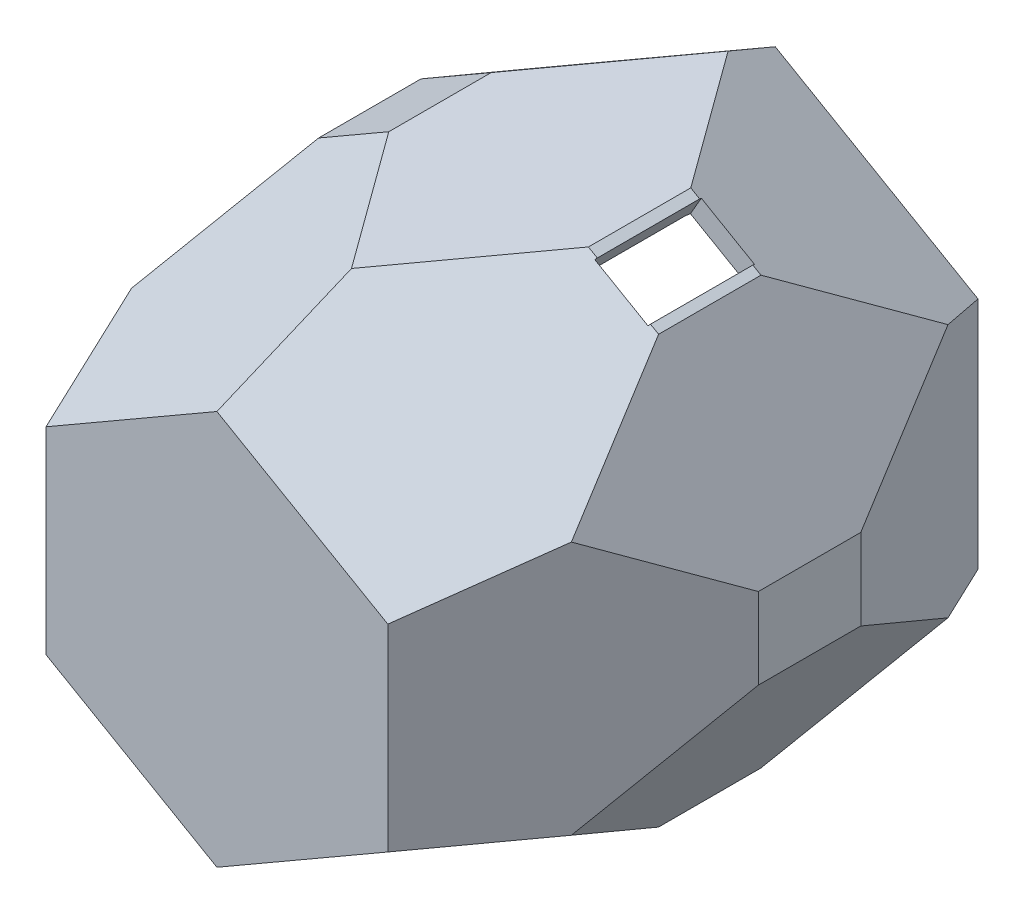
from build123d import *

# Parameters (mm, degrees)
BOSS_EXTRUDE1_DEPTH = 45
BOSS_EXTRUDE1_DRAFT = -20
BOSS_EXTRUDE3_DEPTH = 25
BOSS_EXTRUDE4_DEPTH = 66.34
BOSS_EXTRUDE4_TAPER = 20
SKETCH5_W           = 60
SKETCH5_H           = 136.34
CUT_EXTRUDE4_DEPTH  = 15
CIRPATTERN1_COUNT   = 6
SHELL1_T            = -5
SKETCH6_W           = 15
SKETCH6_H           = 26
CUT_EXTRUDE5_DEPTH  = 10


with BuildPart() as part:
    # Sketch1 → Boss-Extrude1 (with draft: the straight prism first)
    with BuildSketch(Plane.XY):
        Polygon((0, 57.15767665), (-49.5, 28.578838325), (-49.5, -28.578838325), (0, -57.15767665), (49.5, -28.578838325), (49.5, 28.578838325), align=None)
    extrude(amount=BOSS_EXTRUDE1_DEPTH)
    # Boss-Extrude1: the draft: its side faces are tilted about the plane it starts from
    boss_extrude1_sides = [part.faces().sort_by_distance(p)[0] for p in [
        (-24.75, 42.868257487, 22.5),
        (-49.5, 0, 22.5),
        (-24.75, -42.868257487, 22.5),
        (24.75, -42.868257487, 22.5),
        (49.5, 0, 22.5),
        (24.75, 42.868257487, 22.5),
    ]]
    draft(boss_extrude1_sides, Plane.XY, BOSS_EXTRUDE1_DRAFT)

    # Sketch3 → Boss-Extrude3 (add)
    with BuildSketch(Plane.XY.offset(45)):
        Polygon((0, -76.070124796), (65.878660542, -38.035062398), (65.878660542, 38.035062398), (0, 76.070124796), (-65.878660542, 38.035062398), (-65.878660542, -38.035062398), align=None)
    extrude(amount=BOSS_EXTRUDE3_DEPTH)

    # Sketch4 → Boss-Extrude4 (add)
    with BuildSketch(Plane.XY.offset(70)):
        Polygon((65.878660542, -38.035062398), (65.878660542, 38.035062398), (0, 76.070124796), (-65.878660542, 38.035062398), (-65.878660542, -38.035062398), (0, -76.070124796), align=None)
    extrude(amount=BOSS_EXTRUDE4_DEPTH, taper=BOSS_EXTRUDE4_TAPER)

    # Sketch5 → Cut-Extrude4 (cut)
    with BuildSketch(Plane(origin=(0, 77, 0), x_dir=(1, 0, 0), z_dir=(0, 1, 0))):
        with Locations((0, -68.17)):
            Rectangle(SKETCH5_W, SKETCH5_H)
    cut_extrude4 = extrude(amount=-CUT_EXTRUDE4_DEPTH, mode=Mode.SUBTRACT)

    # CirPattern1: Cut-Extrude4 ×6 about axis
    cirpattern1_axis = Axis((0, 0, 0), (0, 0, 1))
    for i in range(1, CIRPATTERN1_COUNT):
        add(cut_extrude4.rotate(cirpattern1_axis, i * 360 / CIRPATTERN1_COUNT), mode=Mode.SUBTRACT)

    # Shell1
    shell1_openings = [part.faces().sort_by_distance(p)[0] for p in [
        (0, 0, 0),
    ]]
    offset(amount=SHELL1_T, openings=shell1_openings, kind=Kind.INTERSECTION)

    # Sketch6 → Cut-Extrude5 (cut)
    with BuildSketch(Plane(origin=(32.939330271, 57.052593597, 0), x_dir=(0.8660254037844417, -0.49999999999999467, 0), z_dir=(0.49999999999999467, 0.8660254037844417, 0))):
        with Locations((0.105187193, -57.5)):
            Rectangle(SKETCH6_W, SKETCH6_H)
    extrude(amount=-CUT_EXTRUDE5_DEPTH, mode=Mode.SUBTRACT)


solid = part.part
